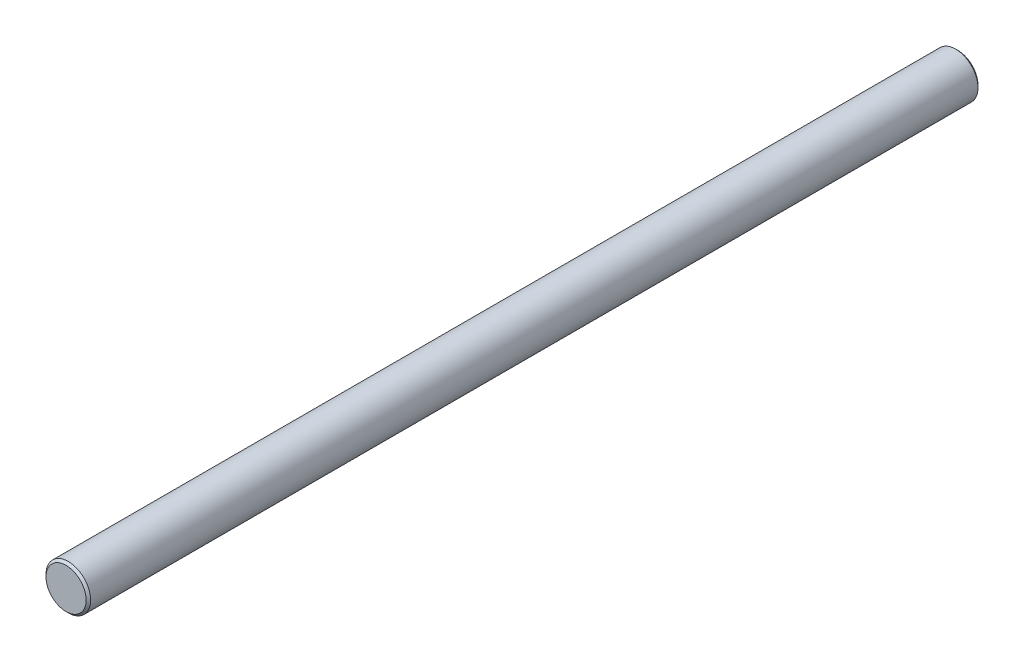
from build123d import *

# Parameters (mm, degrees)
SKETCH_1_R      = 3
EXTRUDE_1_DEPTH = 60
CHAMFER_1_SIZE  = 0.3
CHAMFER_2_SIZE  = 0.3


with BuildPart() as part:
    # 草图1 → 凸台-拉伸1 (new, symmetric)
    with BuildSketch(Plane.XY):
        Circle(SKETCH_1_R)
    extrude(amount=EXTRUDE_1_DEPTH, both=True)

    # 倒角1
    chamfer_1_edges = [part.edges().sort_by_distance(p)[0] for p in [
        (-3, 0, 60),
    ]]
    chamfer(chamfer_1_edges, length=CHAMFER_1_SIZE)

    # 倒角2
    chamfer_2_edges = [part.edges().sort_by_distance(p)[0] for p in [
        (-3, 0, -60),
    ]]
    chamfer(chamfer_2_edges, length=CHAMFER_2_SIZE)


solid = part.part
